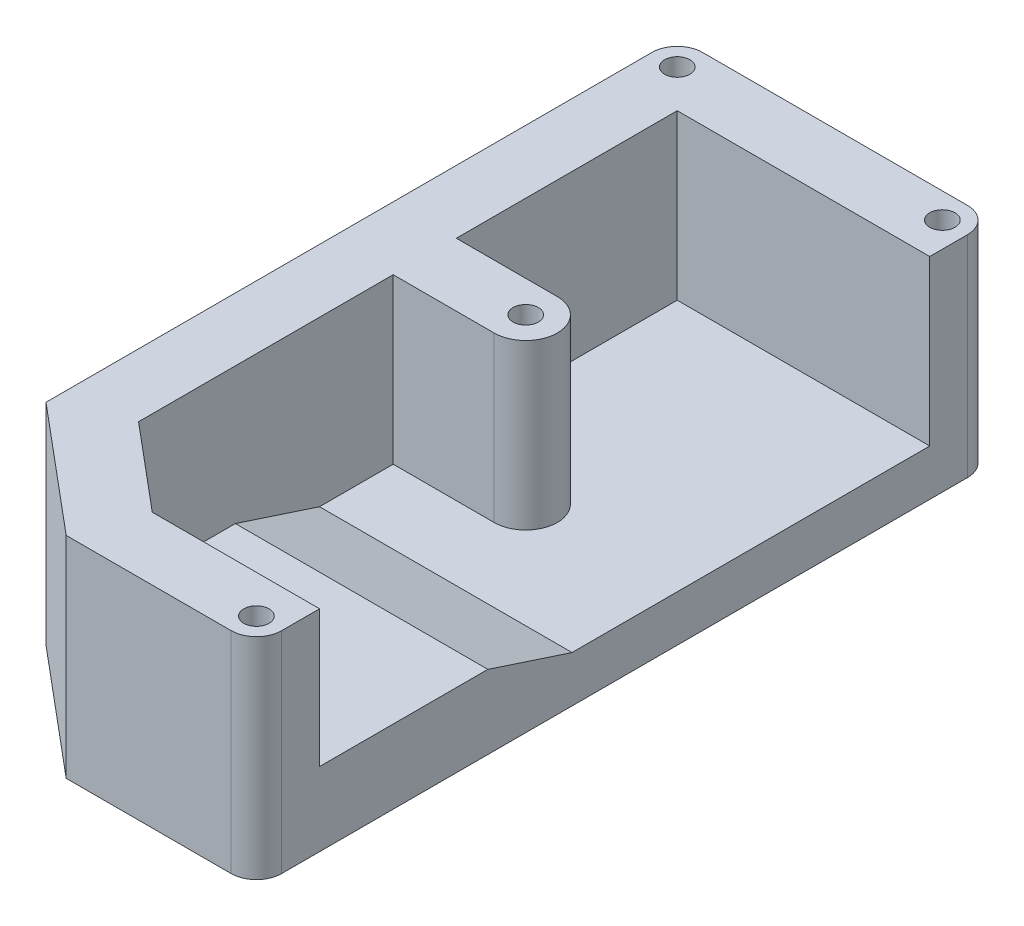
from build123d import *

# Parameters (mm, degrees)
SKETCH2_R           = 2
BOSS_EXTRUDE1_DEPTH = 11
SKETCH3_R           = 2
BOSS_EXTRUDE2_DEPTH = 39
EXTRUDE_THIN1_REACH = 198.85
CUT_EXTRUDE2_START  = -6
SKETCH5_R           = 3
SKETCH5_R_2         = 2
CUT_EXTRUDE2_DEPTH  = 6


with BuildPart() as part:
    # Sketch2 → Boss-Extrude1 (new body)
    with BuildSketch(Plane(origin=(0, 0, 0), x_dir=(1, 0, 0), z_dir=(0, 1, 0))):
        with BuildLine():
            Line((0, -150), (29.793839815, -175))
            Line((29.793839815, -175), (69, -175))
            ThreePointArc((69, -175), (73.242640687, -173.242640687), (75, -169))
            Line((75, -169), (75, -6))
            ThreePointArc((75, -6), (73.242640687, -1.757359313), (69, 0))
            Line((69, 0), (6, 0))
            ThreePointArc((6, 0), (1.757359313, -1.757359313), (0, -6))
            Line((0, -6), (0, -150))
        make_face()
        with Locations(Location((69, -169, 0), (0, 0, 270))):
            Circle(SKETCH2_R, mode=Mode.SUBTRACT)
        with Locations(Location((69, -6, 0), (0, 0, 270))):
            Circle(SKETCH2_R, mode=Mode.SUBTRACT)
        with Locations(Location((6, -6, 0), (0, 0, 270))):
            Circle(SKETCH2_R, mode=Mode.SUBTRACT)
        with Locations(Location((39, -75, 0), (0, 0, 270))):
            Circle(SKETCH2_R, mode=Mode.SUBTRACT)
    extrude(amount=BOSS_EXTRUDE1_DEPTH)

    # Sketch3 → Boss-Extrude2 (add)
    with BuildSketch(Plane(origin=(0, 11, 0), x_dir=(1, 0, 0), z_dir=(0, 1, 0))):
        with BuildLine():
            Line((39, -67.5), (15, -67.5))
            Line((15, -67.5), (15, -15))
            Line((15, -15), (75, -15))
            Line((75, -15), (75, -6))
            ThreePointArc((75, -6), (73.242640687, -1.757359313), (69, 0))
            Line((69, 0), (6, 0))
            ThreePointArc((6, 0), (1.757359313, -1.757359313), (0, -6))
            Line((0, -6), (0, -150))
            Line((0, -150), (29.793839815, -175))
            Line((29.793839815, -175), (69, -175))
            ThreePointArc((69, -175), (73.242640687, -173.242640687), (75, -169))
            Line((75, -169), (75, -160))
            Line((75, -160), (35.253393329, -160))
            Line((35.253393329, -160), (15, -143.005385128))
            Line((15, -143.005385128), (15, -82.5))
            Line((15, -82.5), (39, -82.5))
            ThreePointArc((39, -82.5), (46.5, -75), (39, -67.5))
        make_face()
        with Locations(Location((69, -169, 0), (0, 0, 270))):
            Circle(SKETCH3_R, mode=Mode.SUBTRACT)
        with Locations(Location((6, -6, 0), (0, 0, 270))):
            Circle(SKETCH3_R, mode=Mode.SUBTRACT)
        with Locations(Location((39, -75, 0), (0, 0, 270))):
            Circle(SKETCH3_R, mode=Mode.SUBTRACT)
        with Locations(Location((69, -6, 0), (0, 0, 270))):
            Circle(SKETCH3_R, mode=Mode.SUBTRACT)
    extrude(amount=BOSS_EXTRUDE2_DEPTH)

    # Sketch4 → Extrude-Thin1 (add, up to next)
    with BuildSketch(Plane(origin=(75, 0, 0), x_dir=(0, 0, -1), z_dir=(1, 0, 0)), mode=Mode.PRIVATE) as extrude_thin1_sk1:
        Polygon((-160, 17.535298339), (-120, 17.535298339), (-100, 11), (-103.106030321, 1.494602815), (-121.592395321, 7.535298339), (-160, 7.535298339), align=None)
    extrude_thin1_tool1 = extrude(extrude_thin1_sk1.sketch, amount=-EXTRUDE_THIN1_REACH, mode=Mode.PRIVATE) - part.part
    add(extrude_thin1_tool1.solids().sort_by_distance((75, 11.508735, 130.439328))[0])

    # Sketch5 → Cut-Extrude2 (cut)
    # profile 1 of 5: a face of its own
    with BuildSketch(Plane(origin=(0, 50, 0), x_dir=(1, 0, 0), z_dir=(0, 1, 0)).offset(CUT_EXTRUDE2_START)):
        with Locations(Location((69, -6, 0), (0, 0, 270))):
            Circle(SKETCH5_R)
        with Locations(Location((69, -6, 0), (0, 0, 270))):
            Circle(SKETCH5_R_2, mode=Mode.SUBTRACT)
    # profile 2 of 5: a face of its own
    with BuildSketch(Plane(origin=(0, 50, 0), x_dir=(1, 0, 0), z_dir=(0, 1, 0)).offset(CUT_EXTRUDE2_START)):
        with Locations(Location((6, -6, 0), (0, 0, 270))):
            Circle(SKETCH5_R)
        with Locations(Location((6, -6, 0), (0, 0, 270))):
            Circle(SKETCH5_R_2, mode=Mode.SUBTRACT)
    # profile 3 of 5: a face of its own
    with BuildSketch(Plane(origin=(0, 50, 0), x_dir=(1, 0, 0), z_dir=(0, 1, 0)).offset(CUT_EXTRUDE2_START)):
        with Locations(Location((39, -75, 0), (0, 0, 270))):
            Circle(SKETCH5_R)
        with Locations(Location((39, -75, 0), (0, 0, 270))):
            Circle(SKETCH5_R_2, mode=Mode.SUBTRACT)
    # profile 4 of 5: a face of its own
    with BuildSketch(Plane(origin=(0, 50, 0), x_dir=(1, 0, 0), z_dir=(0, 1, 0)).offset(CUT_EXTRUDE2_START)):
        with Locations(Location((69, -169, 0), (0, 0, 270))):
            Circle(SKETCH5_R)
        with Locations(Location((69, -169, 0), (0, 0, 270))):
            Circle(SKETCH5_R_2, mode=Mode.SUBTRACT)
    # profile 5 of 5: a face of its own
    with BuildSketch(Plane(origin=(0, 50, 0), x_dir=(1, 0, 0), z_dir=(0, 1, 0)).offset(CUT_EXTRUDE2_START)):
        with Locations(Location((69, -6, 0), (0, 0, 270))):
            Circle(SKETCH5_R_2)
    extrude(amount=CUT_EXTRUDE2_DEPTH, mode=Mode.SUBTRACT)


solid = part.part
